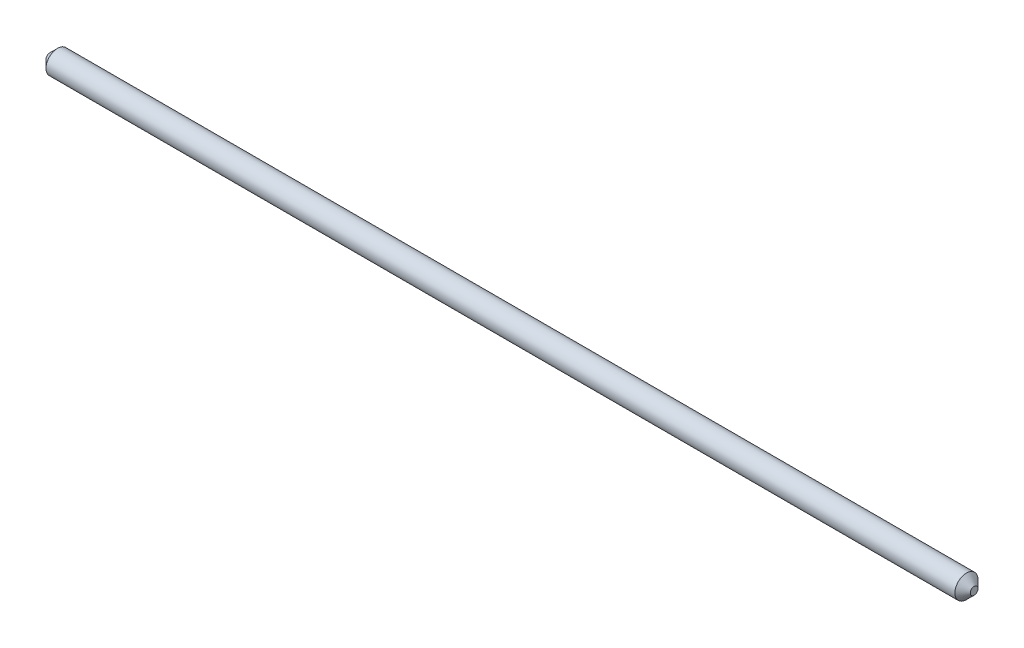
from build123d import *

# Parameters (mm, degrees)
SKETCH1_R           = 1.5
BOSS_EXTRUDE1_DEPTH = 60
CHAMFER1_SIZE       = 1


with BuildPart() as part:
    # Sketch1 → Boss-Extrude1 (new, symmetric)
    with BuildSketch(Plane(origin=(0, 0, 0), x_dir=(0, 0, -1), z_dir=(1, 0, 0))):
        Circle(SKETCH1_R)
    extrude(amount=BOSS_EXTRUDE1_DEPTH, both=True)

    # Chamfer1
    chamfer1_edges = [part.edges().sort_by_distance(p)[0] for p in [
        (-60, 0, 1.5),
        (60, 0, 1.5),
    ]]
    chamfer(chamfer1_edges, length=CHAMFER1_SIZE)


solid = part.part
